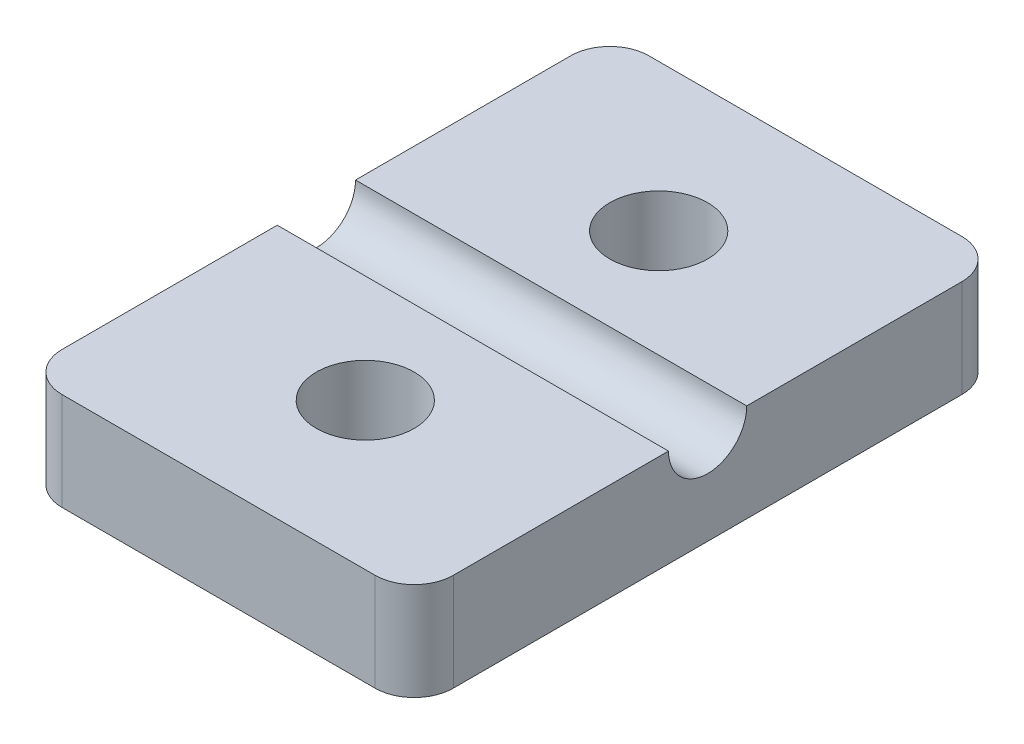
from build123d import *

# Parameters (mm, degrees)
EXTRUDE_1_DEPTH     = 10
SKETCH_2_R          = 1.25
CUT_EXTRUDE_1_DEPTH = 13.747548784
FILLET_1_R          = 1


with BuildPart() as part:
    # 草图1 → 凸台-拉伸1 (new body)
    with BuildSketch(Plane(origin=(0, 0, 0), x_dir=(0, 0, -1), z_dir=(1, 0, 0))):
        with BuildLine():
            Line((7.5, 1.25), (1, 1.25))
            ThreePointArc((1, 1.25), (0, 0.25), (-1, 1.25))
            Line((-1, 1.25), (-7.5, 1.25))
            Line((-7.5, 1.25), (-7.5, -1.25))
            Line((-7.5, -1.25), (7.5, -1.25))
            Line((7.5, -1.25), (7.5, 1.25))
        make_face()
    extrude(amount=EXTRUDE_1_DEPTH)

    # 草图2 → 切除-拉伸1 (cut, through all)
    with BuildSketch(Plane(origin=(0, 1.25, 0), x_dir=(1, 0, 0), z_dir=(0, 1, 0))):
        with Locations(Location((5, 3.75, 0), (0, 0, 270))):
            Circle(SKETCH_2_R)
        with Locations(Location((5, -3.75, 0), (0, 0, 270))):
            Circle(SKETCH_2_R)
    extrude(amount=-CUT_EXTRUDE_1_DEPTH, mode=Mode.SUBTRACT)

    # 圆角1
    fillet_1_edges = [part.edges().sort_by_distance(p)[0] for p in [
        (10, 0, 7.5),
        (10, 0, -7.5),
        (0, 0, -7.5),
        (0, 0, 7.5),
    ]]
    fillet(fillet_1_edges, radius=FILLET_1_R)


solid = part.part
